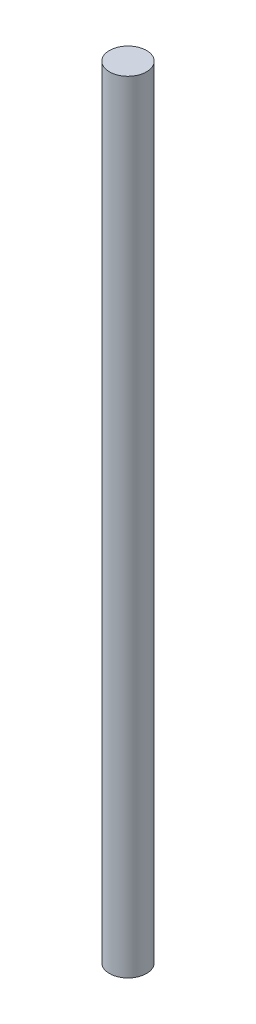
from build123d import *

# Parameters (mm, degrees)
SKETCH_2_R      = 1.9
EXTRUDE_1_DEPTH = 80


with BuildPart() as part:
    # 草图2 → 凸台-拉伸1 (new body)
    with BuildSketch(Plane(origin=(0, 0, 0), x_dir=(1, 0, 0), z_dir=(0, 1, 0))):
        with Locations(Location((0, 0, 0), (0, 0, 270))):
            Circle(SKETCH_2_R)
    extrude(amount=EXTRUDE_1_DEPTH)


solid = part.part
